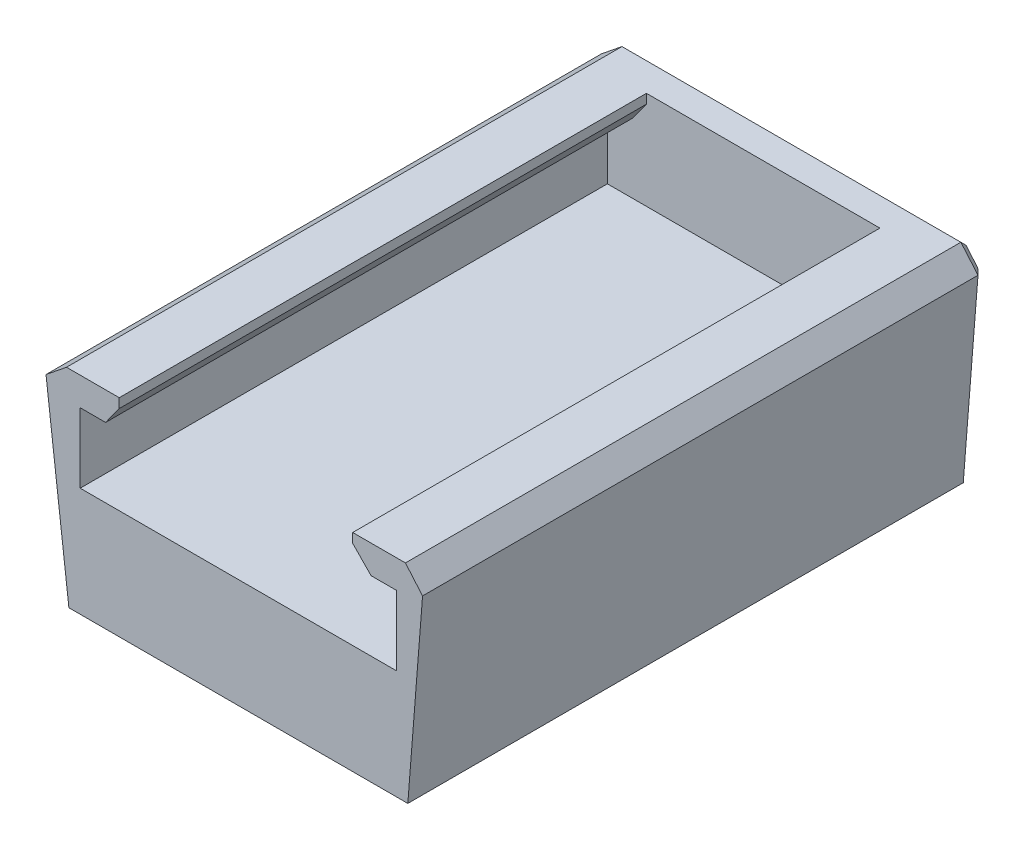
from build123d import *

# Parameters (mm, degrees)
BOSS_EXTRUDE1_DEPTH = 30
BOSS_EXTRUDE2_DEPTH = 2
CHAMFER8_SIZE       = 0.5


with BuildPart() as part:
    # Sketch1 → Boss-Extrude1 (new body)
    with BuildSketch(Plane.XY):
        Polygon((-17.075998832, -1.699461634), (0.924001168, -1.699461634), (1.706939946, 8.236405705), (0.797202797, 9.300538366), (-2.002797203, 9.300538366), (-2.002797203, 8.800538366), (-1.025998832, 7.800538366), (0.324001168, 7.800538366), (0.324001168, 4.100538366), (-16.475998832, 4.100538366), (-16.475998832, 7.800538366), (-15.125998832, 7.800538366), (-14.402797203, 8.800538366), (-14.402797203, 9.300538366), (-17.202797203, 9.300538366), (-18.292206063, 8.421227081), align=None)
    extrude(amount=-BOSS_EXTRUDE1_DEPTH)

    # Sketch2 → Boss-Extrude2 (add)
    with BuildSketch(Plane(origin=(0, 0, -30), x_dir=(-1, 0, 0), z_dir=(0, 0, -1))):
        Polygon((2.002797203, 9.300538366), (14.402797203, 9.300538366), (16.475998832, 9.300538366), (16.475998832, 4.100538366), (-0.324001168, 4.100538366), (-0.324001168, 9.300538366), align=None)
    extrude(amount=-BOSS_EXTRUDE2_DEPTH)

    # Chamfer8
    chamfer8_edges = [part.edges().sort_by_distance(p)[0] for p in [
        (1.315470557, 3.268472036, -30),
        (1.252071371, 8.768472036, -30),
        (-8.202797203, 9.300538366, -30),
        (-17.684102447, 3.360882724, -30),
        (-17.747501633, 8.860882724, -30),
        (-8.075998832, -1.699461634, -30),
    ]]
    chamfer(chamfer8_edges, length=CHAMFER8_SIZE)


solid = part.part
